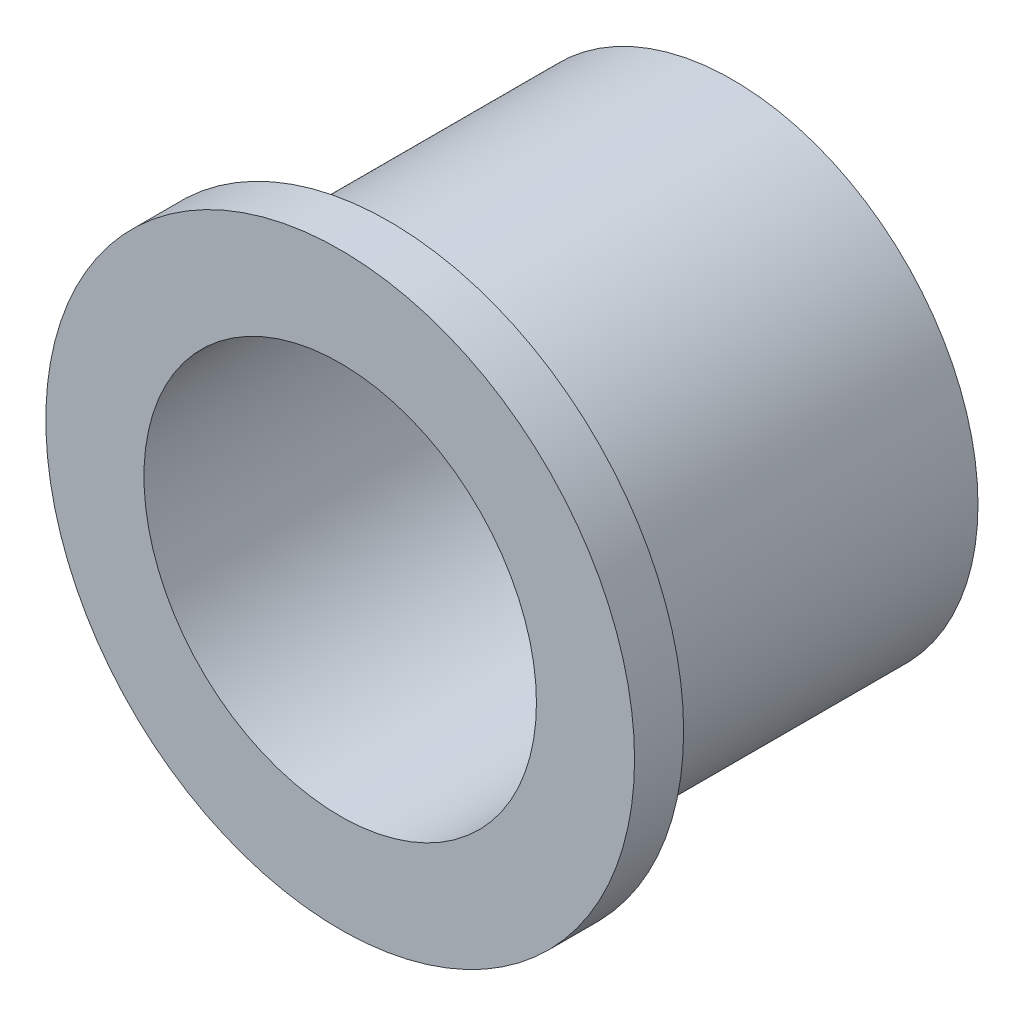
from build123d import *


with BuildPart() as part:
    # Szkic1 → Obrót1 (revolve)
    with BuildSketch(Plane(origin=(0, 0, 0), x_dir=(0, 0, -1), z_dir=(1, 0, 0)), mode=Mode.PRIVATE) as obr_t1_sk:
        Polygon((0, 9), (0, 6), (12, 6), (12, 7.5), (1.5, 7.5), (1.5, 9), align=None)
    revolve(obr_t1_sk.sketch.rotate(Axis((0, 0, 0), (0, 0, -1)), 90), axis=Axis((0, 0, 0), (0, 0, -1)))


solid = part.part
